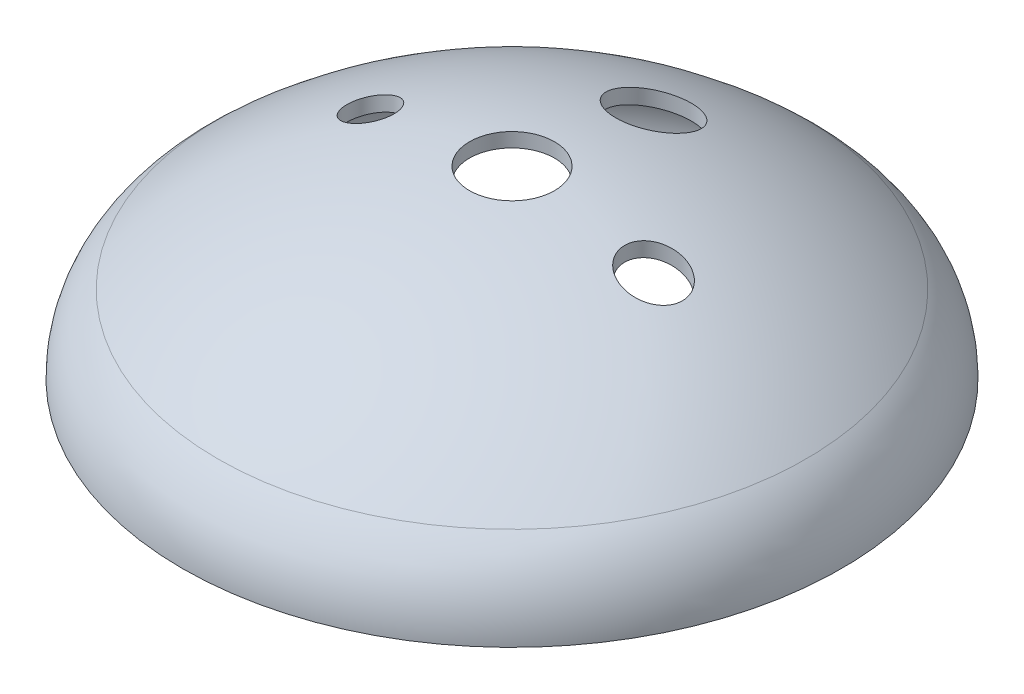
from build123d import *

# Parameters (mm, degrees)
SKETCH_2_R          = 9
SKETCH_2_R_2        = 5.000000000000001
SKETCH_2_R_3        = 7.999999999999998
SKETCH_2_R_4        = 6.124999999999995
CUT_EXTRUDE_1_DEPTH = 107.33743200790742


with BuildPart() as part:
    # Эскиз1 → Повернуть1 (revolve)
    with BuildSketch(Plane.XY, mode=Mode.PRIVATE) as revolve_1_sk:
        with BuildLine():
            Line((0, 39.36501550915903), (0, 36.36501550915897))
            ThreePointArc((0, 36.36501550915897), (32.17757492953397, 30.613071103520923), (60.369714413268355, 14.069659601627245))
            ThreePointArc((60.369714413268355, 14.069659601627245), (65.15206854111862, 7.74515045998565), (66.84999999999997, 1.388e-14))
            Line((66.84999999999997, 1.388e-14), (69.85000000000002, 1.388e-14))
            ThreePointArc((69.85000000000002, 1.388e-14), (67.87693354038171, 9.000184617206603), (62.31964058940756, 16.349525366887885))
            ThreePointArc((62.31964058940756, 16.349525366887885), (33.216902285139106, 33.427284785509414), (0, 39.36501550915903))
        make_face()
    revolve(revolve_1_sk.sketch.rotate(Axis((0, 69.55204547466519, 0), (0, -1, 0)), 90), axis=Axis((0, 69.55204547466519, 0), (0, -1, 0)))

    # Эскиз2 → Вырез-Вытянуть1 (cut, through all)
    with BuildSketch(Plane(origin=(0, 39.36501550915903, 0), x_dir=(1, 0, 0), z_dir=(0, 1, 0))):
        with Locations(Location((0, 0, 0), (0, 0, 90))):
            Circle(SKETCH_2_R)
        with Locations(Location((-30, 0, 0), (0, 0, 137.62120169))):
            Circle(SKETCH_2_R_2)
        with Locations(Location((0, 30, 0), (0, 0, 269.99999999))):
            Circle(SKETCH_2_R_3)
        with Locations(Location((30, 0, 0), (0, 0, 136.859467324))):
            Circle(SKETCH_2_R_4)
    extrude(amount=-CUT_EXTRUDE_1_DEPTH, mode=Mode.SUBTRACT)


solid = part.part
